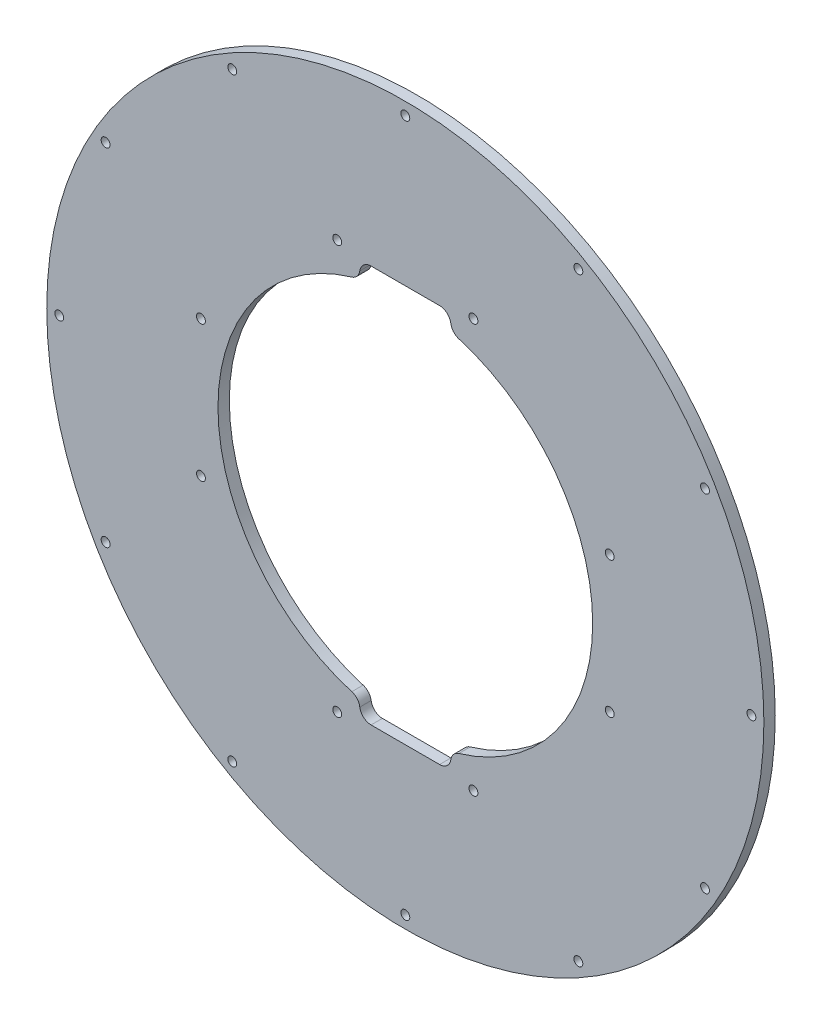
from build123d import *

# Parameters (mm, degrees)
SKETCH1_R                  = 200.533
SKETCH1_R_2                = 104.775
BOSS_EXTRUDE1_DEPTH        = 6.35
F_9_0_196_DIAMETER_HOLE1_D = 4.9784
SKETCH4_W                  = 50.8
SKETCH4_H                  = 9.525
CUT_EXTRUDE1_DEPTH         = 284.66757072
F_9_0_196_DIAMETER_HOLE2_D = 4.9784
FILLET1_R                  = 6.35
FILLET2_R                  = 6.35


with BuildPart() as part:
    # Sketch1 → Boss-Extrude1 (new body)
    with BuildSketch(Plane(origin=(0, 0, 0), x_dir=(0, 1, 0), z_dir=(0, 0, 1))):
        with Locations(Location((0, 0, 0), (0, 0, 270))):
            Circle(SKETCH1_R)
        with Locations(Location((0, 0, 0), (0, 0, 270))):
            Circle(SKETCH1_R_2, mode=Mode.SUBTRACT)
    extrude(amount=BOSS_EXTRUDE1_DEPTH)

    # #9 (0.196) Diameter Hole1 (through all)
    with Locations(Plane.XY.offset(6.35)):
        with Locations((-96.774, 167.617484852), (-167.617484852, 96.774), (-193.548, 0), (-167.617484852, -96.774), (-96.774, -167.617484852), (0, -193.548), (96.774, -167.617484852), (167.617484852, -96.774), (193.548, 0), (167.617484852, 96.774), (96.774, 167.617484852), (0, 193.548)):
            Hole(F_9_0_196_DIAMETER_HOLE1_D / 2)

    # Sketch4 → Cut-Extrude1 (cut, through all)
    with BuildSketch(Plane.XY.offset(6.35)):
        with Locations((0, 106.3625)):
            Rectangle(SKETCH4_W, SKETCH4_H)
        with Locations((0, -106.3625)):
            Rectangle(SKETCH4_W, SKETCH4_H)
    extrude(amount=-CUT_EXTRUDE1_DEPTH, mode=Mode.SUBTRACT)

    # #9 (0.196) Diameter Hole2 (through all)
    with Locations(Plane.XY.offset(6.35)):
        with Locations((-114.3, 38.1), (-114.3, -38.1), (-38.1, -114.3), (38.1, -114.3), (114.3, -38.1), (114.3, 38.1), (38.1, 114.3), (-38.1, 114.3)):
            Hole(F_9_0_196_DIAMETER_HOLE2_D / 2)

    # Fillet1
    fillet1_edges = [part.edges().sort_by_distance(p)[0] for p in [
        (25.4, -101.649597269, 3.175),
        (-25.4, -101.649597269, 3.175),
        (-25.4, 101.649597269, 3.175),
        (25.4, 101.649597269, 3.175),
    ]]
    fillet(fillet1_edges, radius=FILLET1_R)

    # Fillet2
    fillet2_edges = [part.edges().sort_by_distance(p)[0] for p in [
        (25.4, -111.125, 3.175),
        (-25.4, -111.125, 3.175),
        (25.4, 111.125, 3.175),
        (-25.4, 111.125, 3.175),
    ]]
    fillet(fillet2_edges, radius=FILLET2_R)


solid = part.part
